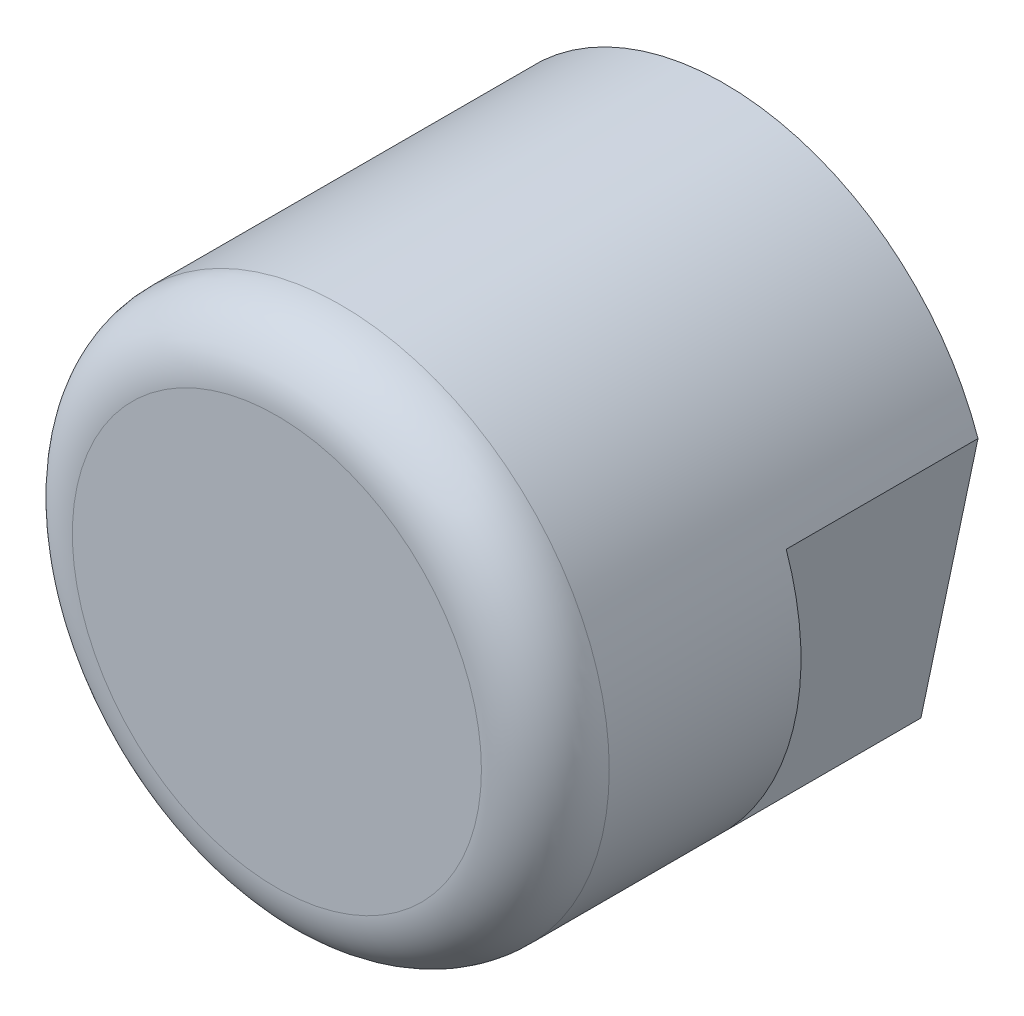
from build123d import *

# Parameters (mm, degrees)
SKETCH1_R           = 21
BOSS_EXTRUDE1_DEPTH = 40
SKETCH2_R           = 21
SKETCH2_R_2         = 10
CUT_EXTRUDE1_DEPTH  = 5
CUT_EXTRUDE2_DEPTH  = 15
FILLET1_R           = 5
SKETCH3_R           = 4.5
CUT_EXTRUDE3_DEPTH  = 10


with BuildPart() as part:
    # Sketch1 → Boss-Extrude1 (new body)
    with BuildSketch(Plane.XY):
        Circle(SKETCH1_R)
    extrude(amount=BOSS_EXTRUDE1_DEPTH)

    # Sketch2 → Cut-Extrude1 (cut)
    with BuildSketch(Plane(origin=(0, 0, 0), x_dir=(-1, 0, 0), z_dir=(0, 0, -1))):
        Circle(SKETCH2_R)
        Circle(SKETCH2_R_2, mode=Mode.SUBTRACT)
    extrude(amount=-CUT_EXTRUDE1_DEPTH, mode=Mode.SUBTRACT)

    # Sketch4 → Cut-Extrude2 (cut)
    with BuildSketch(Plane(origin=(0, 0, 5), x_dir=(-1, 0, 0), z_dir=(0, 0, -1))):
        with BuildLine():
            Line((15.379257562, 14.299595688), (19.84526591, -6.867708567))
            ThreePointArc((19.84526591, -6.867708567), (20.547638692, 4.335267488), (15.379257562, 14.299595688))
        make_face()
    cut_extrude2 = extrude(amount=-CUT_EXTRUDE2_DEPTH, mode=Mode.SUBTRACT)

    # Mirror1: Cut-Extrude2 across plane
    add(cut_extrude2.mirror(Plane(origin=(0, 0, 0), x_dir=(0, 0, 1), z_dir=(-0.9784589853258884, 0.20644130893557386, 0))), mode=Mode.SUBTRACT)

    # Fillet1
    fillet1_edges = [part.edges().sort_by_distance(p)[0] for p in [
        (-21, 0, 40),
    ]]
    fillet(fillet1_edges, radius=FILLET1_R)

    # Sketch3 → Cut-Extrude3 (cut)
    with BuildSketch(Plane(origin=(0, 0, 0), x_dir=(-1, 0, 0), z_dir=(0, 0, -1))):
        Circle(SKETCH3_R)
    extrude(amount=-CUT_EXTRUDE3_DEPTH, mode=Mode.SUBTRACT)


solid = part.part
